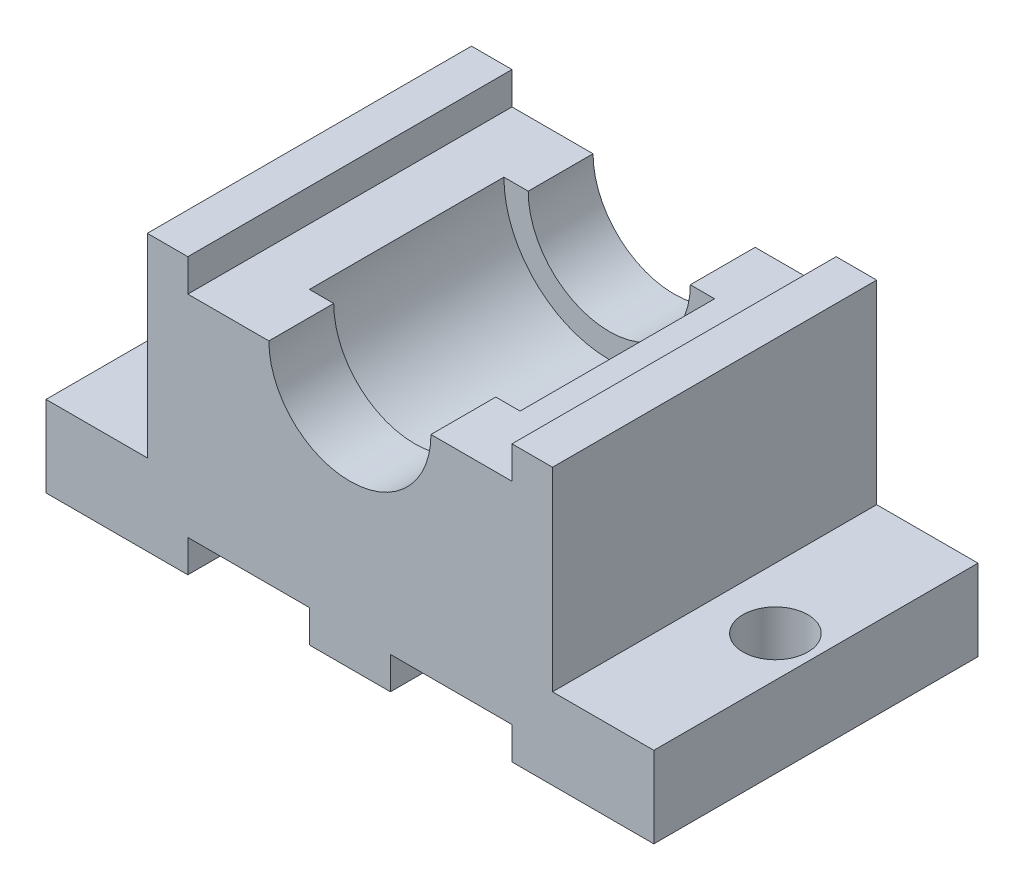
from build123d import *

# Parameters (mm, degrees)
EXTRUDE_1_DEPTH     = 20
SKETCH_2_R          = 13
CUT_EXTRUDE_1_DEPTH = 12
SKETCH_3_R          = 4
CUT_EXTRUDE_2_DEPTH = 49.808298475


with BuildPart() as part:
    # 草图1 → 凸台-拉伸1 (new, symmetric)
    with BuildSketch(Plane.XY):
        with BuildLine():
            Line((-5, 0), (5, 0))
            Line((5, 0), (5, 4))
            Line((5, 4), (20, 4))
            Line((20, 4), (20, 0))
            Line((20, 0), (37.5, 0))
            Line((37.5, 0), (37.5, 10))
            Line((37.5, 10), (25, 10))
            Line((25, 10), (25, 34))
            Line((25, 34), (20, 34))
            Line((20, 34), (20, 30))
            Line((20, 30), (10, 30))
            ThreePointArc((10, 30), (0, 20), (-10, 30))
            Line((-10, 30), (-20, 30))
            Line((-20, 30), (-20, 34))
            Line((-20, 34), (-25, 34))
            Line((-25, 34), (-25, 10))
            Line((-25, 10), (-37.5, 10))
            Line((-37.5, 10), (-37.5, 0))
            Line((-37.5, 0), (-20, 0))
            Line((-20, 0), (-20, 4))
            Line((-20, 4), (-5, 4))
            Line((-5, 4), (-5, 0))
        make_face()
    extrude(amount=EXTRUDE_1_DEPTH, both=True)

    # 草图2 → 切除-拉伸1 (cut, symmetric)
    with BuildSketch(Plane.XY):
        with Locations((0, 30)):
            Circle(SKETCH_2_R)
    extrude(amount=CUT_EXTRUDE_1_DEPTH, both=True, mode=Mode.SUBTRACT)

    # 草图3 → 切除-拉伸2 (cut, through all)
    with BuildSketch(Plane(origin=(0, 10, 0), x_dir=(1, 0, 0), z_dir=(0, 1, 0))):
        with Locations(Location((-32.5, 0, 0), (0, 0, 180))):
            Circle(SKETCH_3_R)
        with Locations(Location((32.5, 0, 0), (0, 0, 180))):
            Circle(SKETCH_3_R)
    extrude(amount=-CUT_EXTRUDE_2_DEPTH, mode=Mode.SUBTRACT)


solid = part.part
